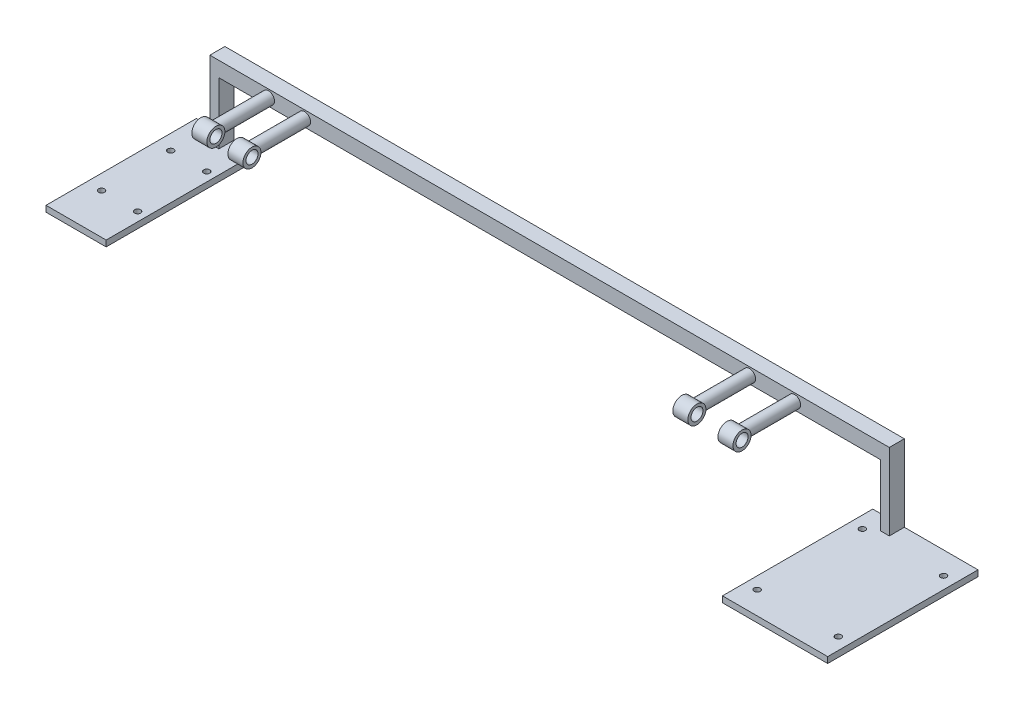
from build123d import *

# Parameters (mm, degrees)
BOSS_EXTRUDE1_DEPTH = 50
SKETCH2_W           = 200
SKETCH2_H           = 20
BOSS_EXTRUDE2_DEPTH = 500
SKETCH4_R           = 20
BOSS_EXTRUDE3_DEPTH = 200
SKETCH6_R           = 30
SKETCH6_R_2         = 12
BOSS_EXTRUDE4_DEPTH = 25
SKETCH8_W           = 350
SKETCH8_H           = 20
BOSS_EXTRUDE5_DEPTH = 500
SKETCH9_R           = 20
CUT_EXTRUDE1_DEPTH  = 2356.175152722
LPATTERN2_COUNT     = 2
LPATTERN2_PITCH     = 1750
LPATTERN4_COUNT     = 2
LPATTERN4_PITCH     = 120
LPATTERN5_COUNT     = 2
LPATTERN5_PITCH     = 1600
CUT_EXTRUDE2_REACH  = 1488.01
SKETCH10_R          = 10
SKETCH11_R          = 10
CUT_EXTRUDE3_DEPTH  = 40


with BuildPart() as part:
    # Sketch1 → Boss-Extrude1 (new body)
    with BuildSketch(Plane.XY):
        Polygon((-1130, 0), (1130, 0), (1130, -255), (1100, -255), (1100, -50), (-1100, -50), (-1100, -255), (-1130, -255), align=None)
    extrude(amount=BOSS_EXTRUDE1_DEPTH)

    # Sketch2 → Boss-Extrude2 (add)
    with BuildSketch(Plane.XY):
        with Locations((-1125, -265)):
            Rectangle(SKETCH2_W, SKETCH2_H)
    extrude(amount=BOSS_EXTRUDE2_DEPTH)

    # Sketch4 → Boss-Extrude3 (add)
    with BuildSketch(Plane.XY.offset(50)):
        with Locations(Location((-935, -25, 0), (0, 0, 180))):
            Circle(SKETCH4_R)
    boss_extrude3 = extrude(amount=BOSS_EXTRUDE3_DEPTH)

    # Sketch6 → Boss-Extrude4 (add, symmetric)
    with BuildSketch(Plane(origin=(-935, 0, 0), x_dir=(0, -1, 0), z_dir=(-1, 0, 0))):
        with Locations(Location((25, 250, 0), (0, 0, 90))):
            Circle(SKETCH6_R)
        with Locations(Location((25, 250, 0), (0, 0, 90))):
            Circle(SKETCH6_R_2, mode=Mode.SUBTRACT)
    boss_extrude4 = extrude(amount=BOSS_EXTRUDE4_DEPTH, both=True)

    # Sketch8 → Boss-Extrude5 (add)
    with BuildSketch(Plane(origin=(0, 0, 0), x_dir=(-1, 0, 0), z_dir=(0, 0, -1))):
        with Locations((-1200, -265)):
            Rectangle(SKETCH8_W, SKETCH8_H)
    extrude(amount=-BOSS_EXTRUDE5_DEPTH)

    # Sketch9 → Cut-Extrude1 (cut, through all)
    with BuildSketch(Plane(origin=(-910, 0, 0), x_dir=(0, 0, -1), z_dir=(1, 0, 0))):
        with Locations((-249.707622987, -24.214075722)):
            Circle(SKETCH9_R)
    cut_extrude1 = extrude(amount=-CUT_EXTRUDE1_DEPTH, mode=Mode.SUBTRACT)

    # LPattern2: Boss-Extrude3, Boss-Extrude4, Cut-Extrude1 ×2
    with Locations(*[(i * LPATTERN2_PITCH, 0, 0) for i in range(1, LPATTERN2_COUNT)]):
        add(boss_extrude3)
        add(boss_extrude4)
        add(cut_extrude1, mode=Mode.SUBTRACT)

    # LPattern4: Boss-Extrude3, Boss-Extrude4, Cut-Extrude1 ×2
    with Locations(*[(i * LPATTERN4_PITCH, 0, 0) for i in range(1, LPATTERN4_COUNT)]):
        add(boss_extrude3)
        add(boss_extrude4)
        add(cut_extrude1, mode=Mode.SUBTRACT)

    # LPattern5: Boss-Extrude3, Boss-Extrude4, Cut-Extrude1 ×2
    with Locations(*[(i * LPATTERN5_PITCH, 0, 0) for i in range(1, LPATTERN5_COUNT)]):
        add(boss_extrude3)
        add(boss_extrude4)
        add(cut_extrude1, mode=Mode.SUBTRACT)

    # Sketch10 → Cut-Extrude2 (cut, up to next)
    with BuildSketch(Plane(origin=(0, -255, 0), x_dir=(1, 0, 0), z_dir=(0, 1, 0)), mode=Mode.PRIVATE) as cut_extrude2_sk1:
        with Locations(Location((1065, -424.7076, 0), (0, 0, 270))):
            Circle(SKETCH10_R)
    cut_extrude2_tool1 = extrude(cut_extrude2_sk1.sketch, amount=-CUT_EXTRUDE2_REACH, mode=Mode.PRIVATE) & part.part
    # Sketch10 → Cut-Extrude2 (cut, up to next)
    with BuildSketch(Plane(origin=(0, -255, 0), x_dir=(1, 0, 0), z_dir=(0, 1, 0)), mode=Mode.PRIVATE) as cut_extrude2_sk2:
        with Locations(Location((1065, -74.7076, 0), (0, 0, 270))):
            Circle(SKETCH10_R)
    cut_extrude2_tool2 = extrude(cut_extrude2_sk2.sketch, amount=-CUT_EXTRUDE2_REACH, mode=Mode.PRIVATE) & part.part
    # Sketch10 → Cut-Extrude2 (cut, up to next)
    with BuildSketch(Plane(origin=(0, -255, 0), x_dir=(1, 0, 0), z_dir=(0, 1, 0)), mode=Mode.PRIVATE) as cut_extrude2_sk3:
        with Locations(Location((1335, -424.7076, 0), (0, 0, 270))):
            Circle(SKETCH10_R)
    cut_extrude2_tool3 = extrude(cut_extrude2_sk3.sketch, amount=-CUT_EXTRUDE2_REACH, mode=Mode.PRIVATE) & part.part
    # Sketch10 → Cut-Extrude2 (cut, up to next)
    with BuildSketch(Plane(origin=(0, -255, 0), x_dir=(1, 0, 0), z_dir=(0, 1, 0)), mode=Mode.PRIVATE) as cut_extrude2_sk4:
        with Locations(Location((1335, -74.7076, 0), (0, 0, 270))):
            Circle(SKETCH10_R)
    cut_extrude2_tool4 = extrude(cut_extrude2_sk4.sketch, amount=-CUT_EXTRUDE2_REACH, mode=Mode.PRIVATE) & part.part
    # Sketch10 → Cut-Extrude2 (cut, up to next)
    with BuildSketch(Plane(origin=(0, -255, 0), x_dir=(1, 0, 0), z_dir=(0, 1, 0)), mode=Mode.PRIVATE) as cut_extrude2_sk5:
        with Locations(Location((-1175, -365.2924, 0), (0, 0, 270))):
            Circle(SKETCH10_R)
    cut_extrude2_tool5 = extrude(cut_extrude2_sk5.sketch, amount=-CUT_EXTRUDE2_REACH, mode=Mode.PRIVATE) & part.part
    # Sketch10 → Cut-Extrude2 (cut, up to next)
    with BuildSketch(Plane(origin=(0, -255, 0), x_dir=(1, 0, 0), z_dir=(0, 1, 0)), mode=Mode.PRIVATE) as cut_extrude2_sk6:
        with Locations(Location((-1055, -365.2924, 0), (0, 0, 270))):
            Circle(SKETCH10_R)
    cut_extrude2_tool6 = extrude(cut_extrude2_sk6.sketch, amount=-CUT_EXTRUDE2_REACH, mode=Mode.PRIVATE) & part.part
    # Sketch10 → Cut-Extrude2 (cut, up to next)
    with BuildSketch(Plane(origin=(0, -255, 0), x_dir=(1, 0, 0), z_dir=(0, 1, 0)), mode=Mode.PRIVATE) as cut_extrude2_sk7:
        with Locations(Location((-1175, -135.2924, 0), (0, 0, 270))):
            Circle(SKETCH10_R)
    cut_extrude2_tool7 = extrude(cut_extrude2_sk7.sketch, amount=-CUT_EXTRUDE2_REACH, mode=Mode.PRIVATE) & part.part
    # Sketch10 → Cut-Extrude2 (cut, up to next)
    with BuildSketch(Plane(origin=(0, -255, 0), x_dir=(1, 0, 0), z_dir=(0, 1, 0)), mode=Mode.PRIVATE) as cut_extrude2_sk8:
        with Locations(Location((-1055, -135.2924, 0), (0, 0, 270))):
            Circle(SKETCH10_R)
    cut_extrude2_tool8 = extrude(cut_extrude2_sk8.sketch, amount=-CUT_EXTRUDE2_REACH, mode=Mode.PRIVATE) & part.part
    add(cut_extrude2_tool1.solids().sort_by_distance((1065, -255, 424.7076))[0], mode=Mode.SUBTRACT)
    add(cut_extrude2_tool2.solids().sort_by_distance((1065, -255, 74.7076))[0], mode=Mode.SUBTRACT)
    add(cut_extrude2_tool3.solids().sort_by_distance((1335, -255, 424.7076))[0], mode=Mode.SUBTRACT)
    add(cut_extrude2_tool4.solids().sort_by_distance((1335, -255, 74.7076))[0], mode=Mode.SUBTRACT)
    add(cut_extrude2_tool5.solids().sort_by_distance((-1175, -255, 365.2924))[0], mode=Mode.SUBTRACT)
    add(cut_extrude2_tool6.solids().sort_by_distance((-1055, -255, 365.2924))[0], mode=Mode.SUBTRACT)
    add(cut_extrude2_tool7.solids().sort_by_distance((-1175, -255, 135.2924))[0], mode=Mode.SUBTRACT)
    add(cut_extrude2_tool8.solids().sort_by_distance((-1055, -255, 135.2924))[0], mode=Mode.SUBTRACT)

    # Sketch11 → Cut-Extrude3 (cut)
    with BuildSketch(Plane(origin=(0, 0, 0), x_dir=(-1, 0, 0), z_dir=(0, 0, -1))):
        with Locations((-100, -25)):
            Circle(SKETCH11_R)
    extrude(amount=-CUT_EXTRUDE3_DEPTH, mode=Mode.SUBTRACT)


solid = part.part
